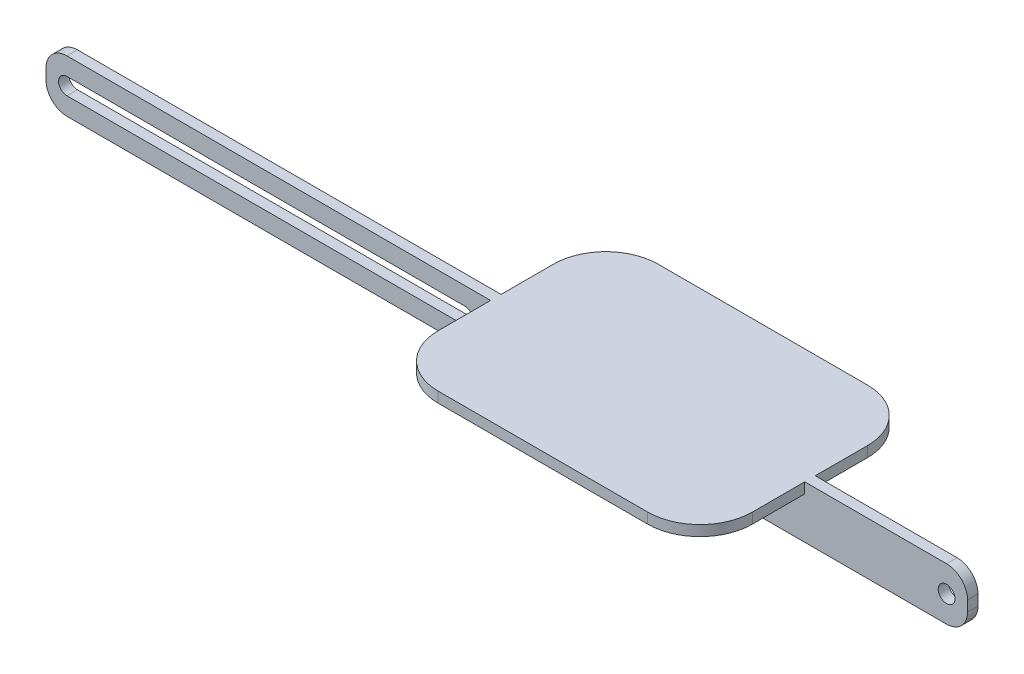
from build123d import *

# Parameters (mm, degrees)
SKETCH1_R                = 4
BOSS_EXTRUDE1_DEPTH      = 5
BOSS_EXTRUDE2_DEPTH      = 50
BOSS_EXTRUDE2_DEPTH_BACK = 55
SKETCH2_W                = 150
SKETCH2_H                = 5
FILLET1_R                = 25


with BuildPart() as part:
    # Sketch1 → Boss-Extrude1 (new body)
    with BuildSketch(Plane.XY):
        with BuildLine():
            Line((-366.666725266, 12.5), (-126.666725266, 12.5))
            Line((-126.666725266, 12.5), (53.333274734, 12.5))
            ThreePointArc((53.333274734, 12.5), (60.404342545, 9.571067812), (63.333274734, 2.5))
            Line((63.333274734, 2.5), (63.333274734, -2.5))
            ThreePointArc((63.333274734, -2.5), (60.404342545, -9.571067812), (53.333274734, -12.5))
            Line((53.333274734, -12.5), (-126.666725266, -12.5))
            Line((-126.666725266, -12.5), (-366.666725266, -12.5))
            ThreePointArc((-366.666725266, -12.5), (-373.737793078, -9.571067812), (-376.666725266, -2.5))
            Line((-376.666725266, -2.5), (-376.666725266, 2.5))
            ThreePointArc((-376.666725266, 2.5), (-373.737793078, 9.571067812), (-366.666725266, 12.5))
        make_face()
        with Locations(Location((53.333274734, 0, 0), (0, 0, 180))):
            Circle(SKETCH1_R, mode=Mode.SUBTRACT)
        with BuildLine():
            Line((-366.666725266, 4), (-176.666725266, 4))
            ThreePointArc((-176.666725266, 4), (-172.666725266, 0), (-176.666725266, -4))
            Line((-176.666725266, -4), (-366.666725266, -4))
            ThreePointArc((-366.666725266, -4), (-370.666725266, 0), (-366.666725266, 4))
        make_face(mode=Mode.SUBTRACT)
    extrude(amount=BOSS_EXTRUDE1_DEPTH)

    # Sketch2 → Boss-Extrude2 (add, two sides: drawn at the far end of the back side and taken through both)
    with BuildSketch(Plane.XY.offset(5).offset(-BOSS_EXTRUDE2_DEPTH_BACK)):
        with Locations((-89.389943781, 10)):
            Rectangle(SKETCH2_W, SKETCH2_H)
    extrude(amount=BOSS_EXTRUDE2_DEPTH + BOSS_EXTRUDE2_DEPTH_BACK)

    # Fillet1
    fillet1_edges = [part.edges().sort_by_distance(p)[0] for p in [
        (-14.389943781, 10, -50),
        (-164.389943781, 10, -50),
        (-164.389943781, 10, 55),
        (-14.389943781, 10, 55),
    ]]
    fillet(fillet1_edges, radius=FILLET1_R)


solid = part.part
